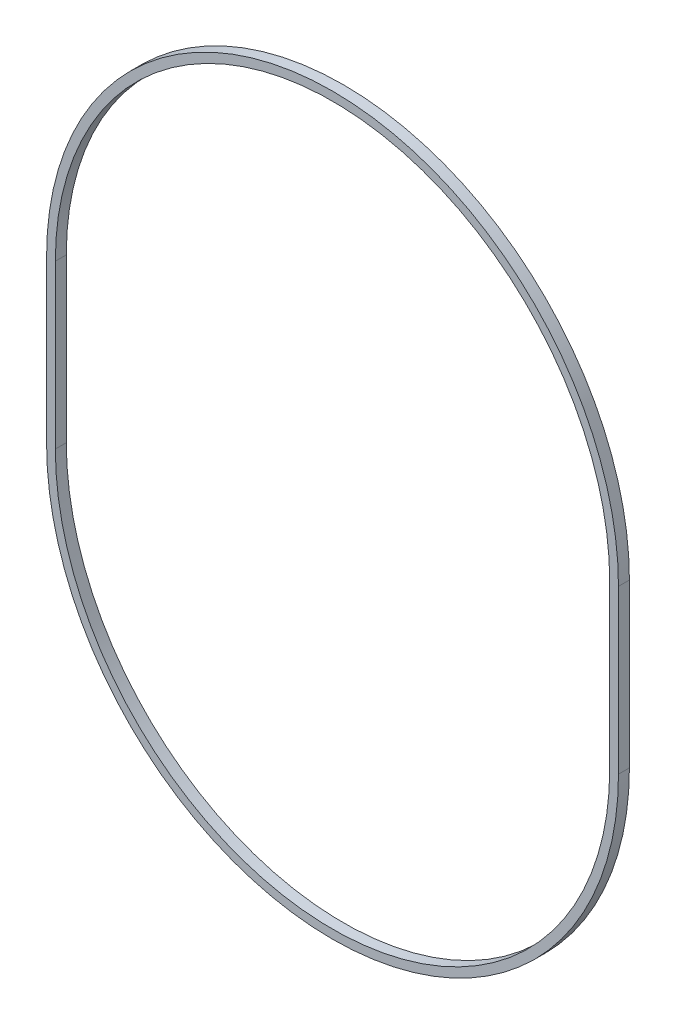
from build123d import *

# Parameters (mm, degrees)
BOSS_EXTRUDE1_DEPTH = 1.875


with BuildPart() as part:
    # Sketch1 → Boss-Extrude1 (new, symmetric)
    with BuildSketch(Plane.XY):
        with BuildLine():
            Line((-98, 27.875), (-98, -27.875))
            ThreePointArc((-98, -27.875), (0, -125.875), (98, -27.875))
            Line((98, -27.875), (98, 27.875))
            ThreePointArc((98, 27.875), (0, 125.875), (-98, 27.875))
        make_face()
        with BuildLine():
            Line((95, -27.875), (95, 27.875))
            ThreePointArc((95, 27.875), (0, 122.875), (-95, 27.875))
            Line((-95, 27.875), (-95, -27.875))
            ThreePointArc((-95, -27.875), (0, -122.875), (95, -27.875))
        make_face(mode=Mode.SUBTRACT)
    extrude(amount=BOSS_EXTRUDE1_DEPTH, both=True)


solid = part.part
